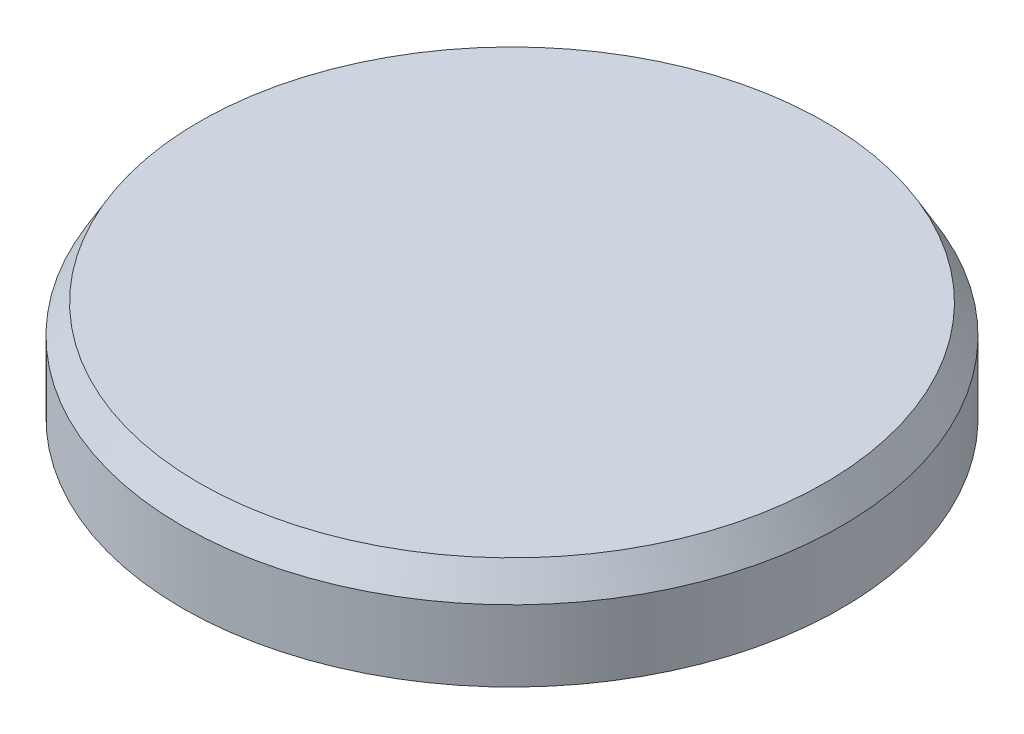
from build123d import *

# Parameters (mm, degrees)
SKETCH_1_R               = 19.75
SKETCH_1_R_2             = 15.75
EXTRUDE_1_DEPTH          = 4
SKETCH_2_R               = 19.75
EXTRUDE_2_DEPTH          = 2
SKETCH_3_R               = 16.5
CUT_EXTRUDE_1_DEPTH      = 4
EXTRUDE_3_DEPTH          = 4
PATTERN_CIRCULAR_1_COUNT = 3
CHAMFER_1_SIZE           = 1
CHAMFER_1_SIZE2          = 1.732050808


with BuildPart() as part:
    # 草图1 → 凸台-拉伸1 (new body)
    with BuildSketch(Plane(origin=(0, 0, 0), x_dir=(1, 0, 0), z_dir=(0, 1, 0))):
        with Locations(Location((0, 0, 0), (0, 0, 270))):
            Circle(SKETCH_1_R)
        with Locations(Location((0, 0, 0), (0, 0, 270))):
            Circle(SKETCH_1_R_2, mode=Mode.SUBTRACT)
    extrude(amount=EXTRUDE_1_DEPTH)

    # 草图2 → 凸台-拉伸2 (add)
    with BuildSketch(Plane(origin=(0, 4, 0), x_dir=(1, 0, 0), z_dir=(0, 1, 0))):
        with Locations(Location((0, 0, 0), (0, 0, 270))):
            Circle(SKETCH_2_R)
    extrude(amount=EXTRUDE_2_DEPTH)

    # 草图3 → 切除-拉伸1 (cut)
    with BuildSketch(Plane.XZ.offset(-4)):
        with Locations(Location((0, 0, 0), (0, 0, 90))):
            Circle(SKETCH_3_R)
    extrude(amount=CUT_EXTRUDE_1_DEPTH, mode=Mode.SUBTRACT)

    # 草图4 → 凸台-拉伸3 (add)
    with BuildSketch(Plane.XZ.offset(-4)):
        with BuildLine():
            ThreePointArc((15.727247344, -4.990359803), (15.284037386, -4.638108653), (15.213331764, -4.07639996))
            ThreePointArc((15.213331764, -4.07639996), (15.75, 0), (15.213331764, 4.07639996))
            ThreePointArc((15.213331764, 4.07639996), (15.284037386, 4.638108653), (15.727247344, 4.990359803))
            ThreePointArc((15.727247344, 4.990359803), (16.5, 0), (15.727247344, -4.990359803))
        make_face()
    extrude_3 = extrude(amount=EXTRUDE_3_DEPTH)

    # 阵列(圆周)1: 凸台-拉伸3 ×3 about axis
    pattern_circular_1_axis = Axis((0, 0, 0), (0, 1, 0))
    for i in range(1, PATTERN_CIRCULAR_1_COUNT):
        add(extrude_3.rotate(pattern_circular_1_axis, i * 360 / PATTERN_CIRCULAR_1_COUNT))

    # 倒角1
    chamfer_1_edges = [part.edges().sort_by_distance(p)[0] for p in [
        (0, 6, -19.75),
    ]]
    chamfer_1_side = [part.faces().sort_by_distance(p)[0] for p in [
        (0, 6, 0),
    ]]
    chamfer(chamfer_1_edges, length=CHAMFER_1_SIZE, length2=CHAMFER_1_SIZE2, reference=chamfer_1_side[0])


solid = part.part
